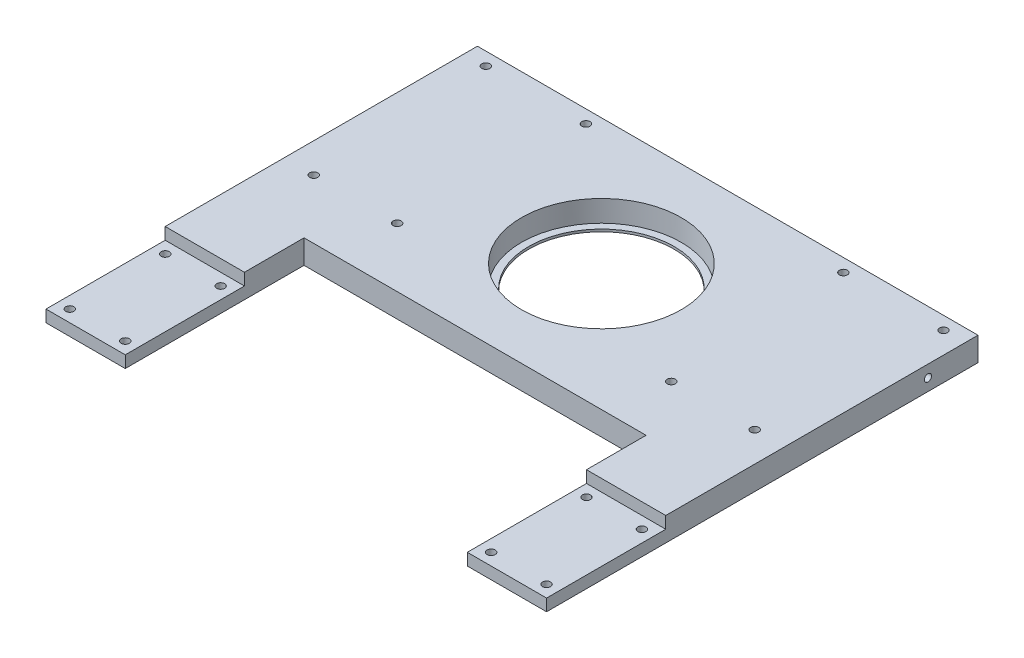
from build123d import *

# Parameters (mm, degrees)
SKIZZE1_W                        = 210
SKIZZE1_H                        = 420
AUFSATZ_LINEAR_AUSTRAGEN1_DEPTH  = 10
SKIZZE5_W                        = 210
SKIZZE5_H                        = 85
SCHNITT_LINEAR_AUSTRAGEN2_DEPTH  = 10
SKIZZE6_R                        = 1.7
SCHNITT_LINEAR_AUSTRAGEN3_DEPTH  = 236
SCHNITT_LINEAR_AUSTRAGEN4_DEPTH  = 4
SKIZZE16_W                       = 35
SKIZZE16_H                       = 7
SCHNITT_LINEAR_AUSTRAGEN10_DEPTH = 5
SCHNITT_LINEAR_AUSTRAGEN11_DEPTH = 35
SKIZZE20_R                       = 1.7
SCHNITT_LINEAR_AUSTRAGEN12_DEPTH = 236
SKIZZE21_W                       = 143.493506494
SKIZZE21_H                       = 75
SCHNITT_LINEAR_AUSTRAGEN13_DEPTH = 236
SCHNITT_LINEAR_AUSTRAGEN14_DEPTH = 236
AUFSATZ_LINEAR_AUSTRAGEN6_DEPTH  = 10
SKIZZE25_R                       = 1.7
SCHNITT_LINEAR_AUSTRAGEN15_DEPTH = 236
SCHNITT_LINEAR_AUSTRAGEN16_DEPTH = 298.153159162
SKIZZE27_R                       = 33.5
SCHNITT_LINEAR_AUSTRAGEN17_DEPTH = 164.554272338
SKIZZE28_R                       = 36.006256149
SKIZZE28_R_2                     = 30.5
AUFSATZ_LINEAR_AUSTRAGEN7_DEPTH  = 1
SKIZZE29_R                       = 1.5
SCHNITT_LINEAR_AUSTRAGEN18_DEPTH = 10
SKIZZE30_R                       = 1.5
SCHNITT_LINEAR_AUSTRAGEN19_DEPTH = 10
SKIZZE31_R                       = 2.95
SCHNITT_LINEAR_AUSTRAGEN20_DEPTH = 3.5


with BuildPart() as part:
    # Skizze1 → Aufsatz-Linear austragen1 (new body)
    with BuildSketch(Plane(origin=(0, 0, 0), x_dir=(1, 0, 0), z_dir=(0, 1, 0))):
        Rectangle(SKIZZE1_W, SKIZZE1_H)
    extrude(amount=AUFSATZ_LINEAR_AUSTRAGEN1_DEPTH)

    # Skizze5 → Schnitt-Linear austragen2 (cut)
    with BuildSketch(Plane(origin=(0, 10, 0), x_dir=(1, 0, 0), z_dir=(0, 1, 0))):
        Polygon((105, -210), (18, -210), (105, -56), align=None)
        Polygon((-18, -210), (-105, -56), (-105, -210), align=None)
        with Locations((0, 167.5)):
            Rectangle(SKIZZE5_W, SKIZZE5_H)
        Polygon((71.746753247, -56), (-71.746753247, -56), (-2.824675325, -178), (2.824675325, -178), align=None)
    extrude(amount=-SCHNITT_LINEAR_AUSTRAGEN2_DEPTH, mode=Mode.SUBTRACT)

    # Skizze6 → Schnitt-Linear austragen3 (cut, through all)
    with BuildSketch(Plane(origin=(0, 10, 0), x_dir=(1, 0, 0), z_dir=(0, 1, 0))):
        with Locations(Location((-11, -205, 0), (0, 0, 270))):
            Circle(SKIZZE6_R)
        with Locations(Location((-11, -188.18, 0), (0, 0, 90))):
            Circle(SKIZZE6_R)
        with Locations(Location((11, -205, 0), (0, 0, 90))):
            Circle(SKIZZE6_R)
        with Locations(Location((11, -188.18, 0), (0, 0, 270))):
            Circle(SKIZZE6_R)
    extrude(amount=-SCHNITT_LINEAR_AUSTRAGEN3_DEPTH, mode=Mode.SUBTRACT)

    # Skizze7 → Schnitt-Linear austragen4 (cut)
    with BuildSketch(Plane.XZ):
        Polygon((-11, 208.406366588), (-8.05, 206.703183294), (-8.05, 203.296816706), (-11, 201.593633412), (-13.95, 203.296816706), (-13.95, 206.703183294), align=None)
        Polygon((11, 208.406366588), (8.05, 206.703183294), (8.05, 203.296816706), (11, 201.593633412), (13.95, 203.296816706), (13.95, 206.703183294), align=None)
        Polygon((-8.05, 186.476816706), (-8.05, 189.883183294), (-11, 191.586366588), (-13.95, 189.883183294), (-13.95, 186.476816706), (-11, 184.773633412), align=None)
        Polygon((8.05, 186.476816706), (8.05, 189.883183294), (11, 191.586366588), (13.95, 189.883183294), (13.95, 186.476816706), (11, 184.773633412), align=None)
    extrude(amount=-SCHNITT_LINEAR_AUSTRAGEN4_DEPTH, mode=Mode.SUBTRACT)

    # Skizze16 → Schnitt-Linear austragen10 (cut)
    with BuildSketch(Plane.XZ):
        with Locations((0, 196.59)):
            Rectangle(SKIZZE16_W, SKIZZE16_H)
    extrude(amount=-SCHNITT_LINEAR_AUSTRAGEN10_DEPTH, mode=Mode.SUBTRACT)

    # Skizze17 → Schnitt-Linear austragen11 (cut)
    with BuildSketch(Plane.ZY.offset(-17.5)):
        Polygon((193.09, 5), (196.59, 8.5), (200.09, 5), align=None)
    extrude(amount=SCHNITT_LINEAR_AUSTRAGEN11_DEPTH, mode=Mode.SUBTRACT)

    # Skizze20 → Schnitt-Linear austragen12 (cut, through all)
    with BuildSketch(Plane(origin=(0, 10, 0), x_dir=(1, 0, 0), z_dir=(0, 1, 0))):
        with Locations(Location((96, 119.52, 0), (0, 0, 270))):
            Circle(SKIZZE20_R)
        with Locations(Location((54, 119.52, 0), (0, 0, 270))):
            Circle(SKIZZE20_R)
        with Locations(Location((-54, 119.52, 0), (0, 0, 90))):
            Circle(SKIZZE20_R)
        with Locations(Location((-96, 119.52, 0), (0, 0, 90))):
            Circle(SKIZZE20_R)
        with Locations(Location((92.5, 43.82, 0), (0, 0, 270))):
            Circle(SKIZZE20_R)
        with Locations(Location((57.5, 43.82, 0), (0, 0, 270))):
            Circle(SKIZZE20_R)
        with Locations(Location((-92.5, 43.82, 0), (0, 0, 90))):
            Circle(SKIZZE20_R)
        with Locations(Location((-57.5, 43.82, 0), (0, 0, 90))):
            Circle(SKIZZE20_R)
    extrude(amount=-SCHNITT_LINEAR_AUSTRAGEN12_DEPTH, mode=Mode.SUBTRACT)

    # Skizze21 → Schnitt-Linear austragen13 (cut, through all)
    with BuildSketch(Plane(origin=(0, 10, 0), x_dir=(1, 0, 0), z_dir=(0, 1, 0))):
        with Locations((0, -18.5)):
            Rectangle(SKIZZE21_W, SKIZZE21_H)
    extrude(amount=-SCHNITT_LINEAR_AUSTRAGEN13_DEPTH, mode=Mode.SUBTRACT)

    # Skizze22 → Schnitt-Linear austragen14 (cut, through all)
    with BuildSketch(Plane(origin=(0, 10, 0), x_dir=(1, 0, 0), z_dir=(0, 1, 0))):
        with BuildLine():
            Line((-71.746753247, -56), (-2.824675325, -178))
            ThreePointArc((-2.824675325, -178), (-55.506711033, -127.293679981), (-71.746753247, -56))
        make_face()
    schnitt_linear_austragen14 = extrude(amount=-SCHNITT_LINEAR_AUSTRAGEN14_DEPTH, mode=Mode.SUBTRACT)

    # Skizze23 → Aufsatz-Linear austragen6 (add)
    with BuildSketch(Plane(origin=(0, 10, 0), x_dir=(1, 0, 0), z_dir=(0, 1, 0))):
        with BuildLine():
            Line((-105, -56), (-18, -210))
            ThreePointArc((-18, -210), (-78.088357737, -142.371344955), (-105, -56))
        make_face()
    aufsatz_linear_austragen6 = extrude(amount=-AUFSATZ_LINEAR_AUSTRAGEN6_DEPTH)

    # Spiegeln2: Schnitt-Linear austragen14, Aufsatz-Linear austragen6 across plane
    add(schnitt_linear_austragen14.mirror(Plane(origin=(0, 0, 0), x_dir=(0, 0, 1), z_dir=(1, 0, 0))), mode=Mode.SUBTRACT)
    add(aufsatz_linear_austragen6.mirror(Plane(origin=(0, 0, 0), x_dir=(0, 0, 1), z_dir=(1, 0, 0))))

    # Skizze25 → Schnitt-Linear austragen15 (cut, through all)
    with BuildSketch(Plane(origin=(0, 10, 0), x_dir=(1, 0, 0), z_dir=(0, 1, 0))):
        with Locations(Location((-100, -11, 0), (0, 0, 270))):
            Circle(SKIZZE25_R)
        with Locations(Location((-76.746753247, -11, 0), (0, 0, 90))):
            Circle(SKIZZE25_R)
        with Locations(Location((-76.746753247, -51, 0), (0, 0, 270))):
            Circle(SKIZZE25_R)
        with Locations(Location((-100, -51, 0), (0, 0, 90))):
            Circle(SKIZZE25_R)
    schnitt_linear_austragen15 = extrude(amount=-SCHNITT_LINEAR_AUSTRAGEN15_DEPTH, mode=Mode.SUBTRACT)

    # Spiegeln3: Schnitt-Linear austragen15 across plane
    add(schnitt_linear_austragen15.mirror(Plane(origin=(0, 0, 0), x_dir=(0, 0, 1), z_dir=(1, 0, 0))), mode=Mode.SUBTRACT)

    # Skizze26 → Schnitt-Linear austragen16 (cut, through all)
    with BuildSketch(Plane.ZY.offset(105)):
        Polygon((6, 5), (6, 13.101486595), (200.684563047, 82.546277137), (242.997216492, -41.037631402), (91.241487897, -60.284782055), (56, 0), (56, 5), align=None)
    extrude(amount=-SCHNITT_LINEAR_AUSTRAGEN16_DEPTH, mode=Mode.SUBTRACT)

    # Skizze27 → Schnitt-Linear austragen17 (cut, through all)
    with BuildSketch(Plane(origin=(0, 10, 0), x_dir=(1, 0, 0), z_dir=(0, 1, 0))):
        with Locations(Location((0, 72, 0), (0, 0, 270))):
            Circle(SKIZZE27_R)
    extrude(amount=-SCHNITT_LINEAR_AUSTRAGEN17_DEPTH, mode=Mode.SUBTRACT)

    # Skizze28 → Aufsatz-Linear austragen7 (add)
    with BuildSketch(Plane.XZ):
        with Locations((0, -72)):
            Circle(SKIZZE28_R)
        with Locations(Location((0, -72, 0), (0, 0, 270))):
            Circle(SKIZZE28_R_2, mode=Mode.SUBTRACT)
    extrude(amount=-AUFSATZ_LINEAR_AUSTRAGEN7_DEPTH)

    # Skizze29 → Schnitt-Linear austragen18 (cut)
    with BuildSketch(Plane.ZY.offset(105)):
        with Locations((-104, 5)):
            Circle(SKIZZE29_R)
    schnitt_linear_austragen18 = extrude(amount=-SCHNITT_LINEAR_AUSTRAGEN18_DEPTH, mode=Mode.SUBTRACT)

    # Skizze30 → Schnitt-Linear austragen19 (cut)
    with BuildSketch(Plane(origin=(0, 0, -125), x_dir=(-1, 0, 0), z_dir=(0, 0, -1))):
        with Locations((100, 5)):
            Circle(SKIZZE30_R)
        with Locations((84, 5)):
            Circle(SKIZZE30_R)
    schnitt_linear_austragen19 = extrude(amount=-SCHNITT_LINEAR_AUSTRAGEN19_DEPTH, mode=Mode.SUBTRACT)

    # Spiegeln4: Schnitt-Linear austragen18, Schnitt-Linear austragen19 across plane
    add(schnitt_linear_austragen18.mirror(Plane(origin=(0, 0, 0), x_dir=(0, 0, 1), z_dir=(1, 0, 0))), mode=Mode.SUBTRACT)
    add(schnitt_linear_austragen19.mirror(Plane(origin=(0, 0, 0), x_dir=(0, 0, 1), z_dir=(1, 0, 0))), mode=Mode.SUBTRACT)

    # Skizze31 → Schnitt-Linear austragen20 (cut)
    with BuildSketch(Plane.XZ):
        with Locations(Location((-96, -119.52, 0), (0, 0, 270))):
            Circle(SKIZZE31_R)
        with Locations(Location((-54, -119.52, 0), (0, 0, 270))):
            Circle(SKIZZE31_R)
        with Locations(Location((-92.5, -43.82, 0), (0, 0, 270))):
            Circle(SKIZZE31_R)
        with Locations(Location((-57.5, -43.82, 0), (0, 0, 270))):
            Circle(SKIZZE31_R)
        with Locations(Location((57.5, -43.82, 0), (0, 0, 90))):
            Circle(SKIZZE31_R)
        with Locations(Location((92.5, -43.82, 0), (0, 0, 90))):
            Circle(SKIZZE31_R)
        with Locations(Location((54, -119.52, 0), (0, 0, 90))):
            Circle(SKIZZE31_R)
        with Locations(Location((96, -119.52, 0), (0, 0, 90))):
            Circle(SKIZZE31_R)
    extrude(amount=-SCHNITT_LINEAR_AUSTRAGEN20_DEPTH, mode=Mode.SUBTRACT)


solid = part.part
